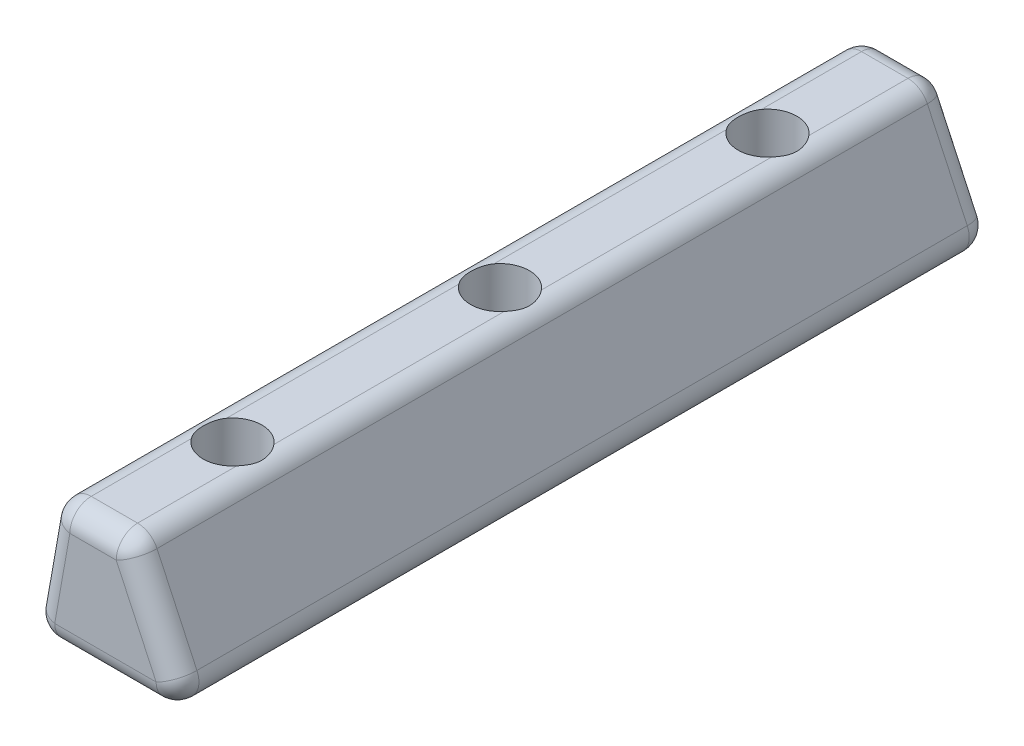
from build123d import *

# Parameters (mm, degrees)
EXTRUDE_1_DEPTH     = 76
SKETCH_2_R          = 1.55
CUT_EXTRUDE_1_DEPTH = 79.390050389
FILLET_1_R          = 2
SKETCH_3_R          = 2.75
CUT_EXTRUDE_2_DEPTH = 8


with BuildPart() as part:
    # 草图1 → 凸台-拉伸1 (new body)
    with BuildSketch(Plane.XY):
        Polygon((0, 0), (15, 0), (9.404308102, 12), (2.115923769, 12), align=None)
    extrude(amount=EXTRUDE_1_DEPTH)

    # 草图2 → 切除-拉伸1 (cut, through all)
    with BuildSketch(Plane.XZ):
        with Locations(Location((6, 63, 0), (0, 0, 270))):
            Circle(SKETCH_2_R)
        with Locations(Location((6, 13, 0), (0, 0, 270))):
            Circle(SKETCH_2_R)
        with Locations(Location((6, 38, 0), (0, 0, 270))):
            Circle(SKETCH_2_R)
    extrude(amount=-CUT_EXTRUDE_1_DEPTH, mode=Mode.SUBTRACT)

    # 圆角1
    fillet_1_edges = [part.edges().sort_by_distance(p)[0] for p in [
        (12.202154051, 6, 76),
        (5.760115935, 12, 76),
        (1.057961884, 6, 76),
        (5.760115935, 12, 0),
        (12.202154051, 6, 0),
        (7.5, 0, 0),
        (1.057961884, 6, 0),
        (2.115923769, 12, 38),
        (9.404308102, 12, 38),
        (15, 0, 38),
        (0, 0, 38),
        (7.5, 0, 76),
    ]]
    fillet(fillet_1_edges, radius=FILLET_1_R)

    # 草图3 → 切除-拉伸2 (cut)
    with BuildSketch(Plane(origin=(0, 12, 0), x_dir=(1, 0, 0), z_dir=(0, 1, 0))):
        with Locations(Location((6, -13, 0), (0, 0, 270))):
            Circle(SKETCH_3_R)
        with Locations(Location((6, -38, 0), (0, 0, 270))):
            Circle(SKETCH_3_R)
        with Locations(Location((6, -63, 0), (0, 0, 270))):
            Circle(SKETCH_3_R)
    extrude(amount=-CUT_EXTRUDE_2_DEPTH, mode=Mode.SUBTRACT)


solid = part.part
